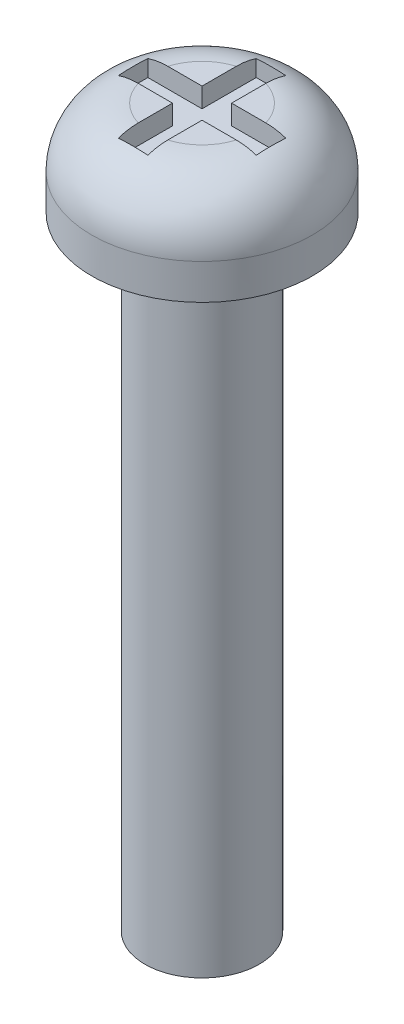
from build123d import *

# Parameters (mm, degrees)
FILLET1_R          = 1.5
CUT_EXTRUDE1_DEPTH = 0.5


with BuildPart() as part:
    # Sketch1 → Revolve1 (revolve)
    with BuildSketch(Plane.XY, mode=Mode.PRIVATE) as revolve1_sk:
        Polygon((0, 18.4), (2.8, 18.4), (2.8, 16), (1.45, 16), (1.45, 0.2), (1, 0), (0, 0), align=None)
    revolve(revolve1_sk.sketch.rotate(Axis((0, 0, 0), (0, 1, 0)), 90), axis=Axis((0, 0, 0), (0, 1, 0)))

    # Fillet1
    fillet1_edges = [part.edges().sort_by_distance(p)[0] for p in [
        (0, 18.4, 2.8),
    ]]
    fillet(fillet1_edges, radius=FILLET1_R)

    # Sketch2 → Cut-Extrude1 (cut)
    with BuildSketch(Plane(origin=(0, 18.4, 0), x_dir=(1, 0, 0), z_dir=(0, 1, 0))):
        Polygon((1.75, 0.375), (1.75, -0.375), (0.375, -0.375), (0.375, -1.75), (-0.375, -1.75), (-0.375, -0.375), (-1.75, -0.375), (-1.75, 0.375), (-0.375, 0.375), (-0.375, 1.75), (0.375, 1.75), (0.375, 0.375), align=None)
    extrude(amount=-CUT_EXTRUDE1_DEPTH, mode=Mode.SUBTRACT)


solid = part.part
